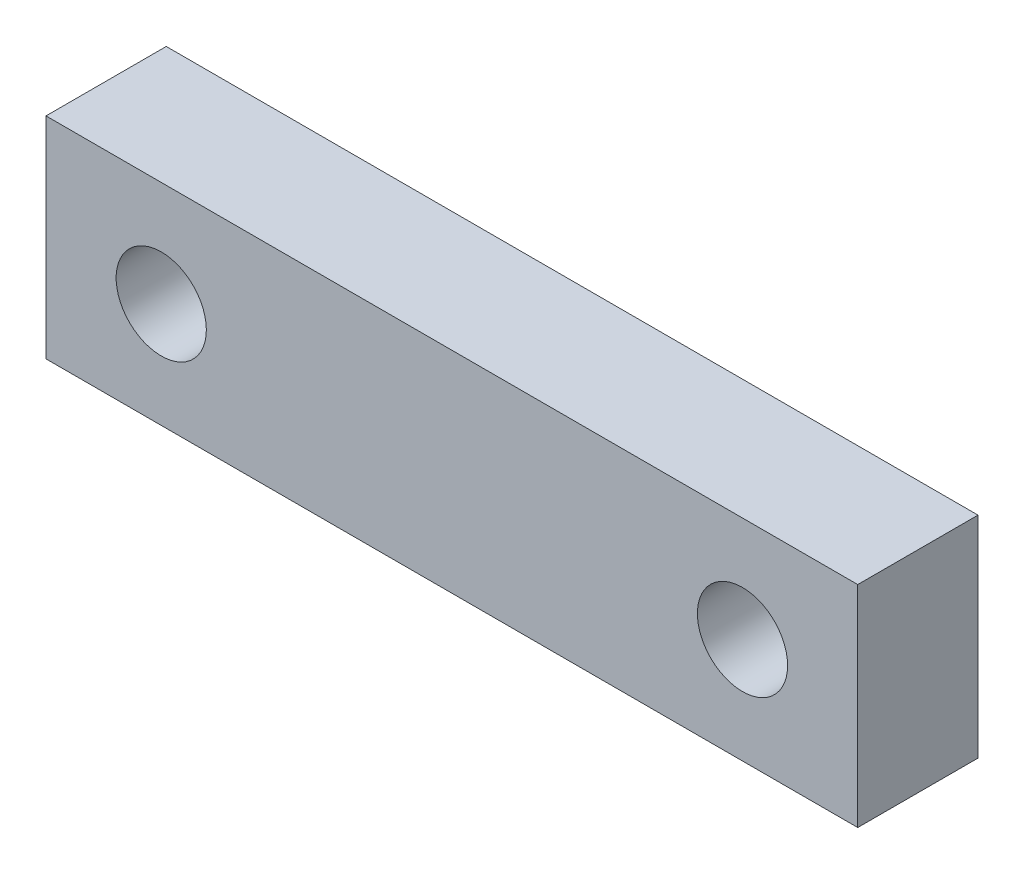
from build123d import *

# Parameters (mm, degrees)
BOSS_EXTRUDE1_DEPTH      = 3
BOSS_EXTRUDE1_DEPTH_BACK = 3
SKETCH1_W                = 40.5
SKETCH1_H                = 10.5
SKETCH1_R                = 2.25


with BuildPart() as part:
    # Sketch1 → Boss-Extrude1 (new, two sides: drawn at the far end of the back side and taken through both)
    with BuildSketch(Plane.XY.offset(-BOSS_EXTRUDE1_DEPTH_BACK)):
        Rectangle(SKETCH1_W, SKETCH1_H)
        with Locations((-14.5, 0)):
            Circle(SKETCH1_R, mode=Mode.SUBTRACT)
        with Locations((14.5, 0)):
            Circle(SKETCH1_R, mode=Mode.SUBTRACT)
    extrude(amount=BOSS_EXTRUDE1_DEPTH + BOSS_EXTRUDE1_DEPTH_BACK)


solid = part.part
